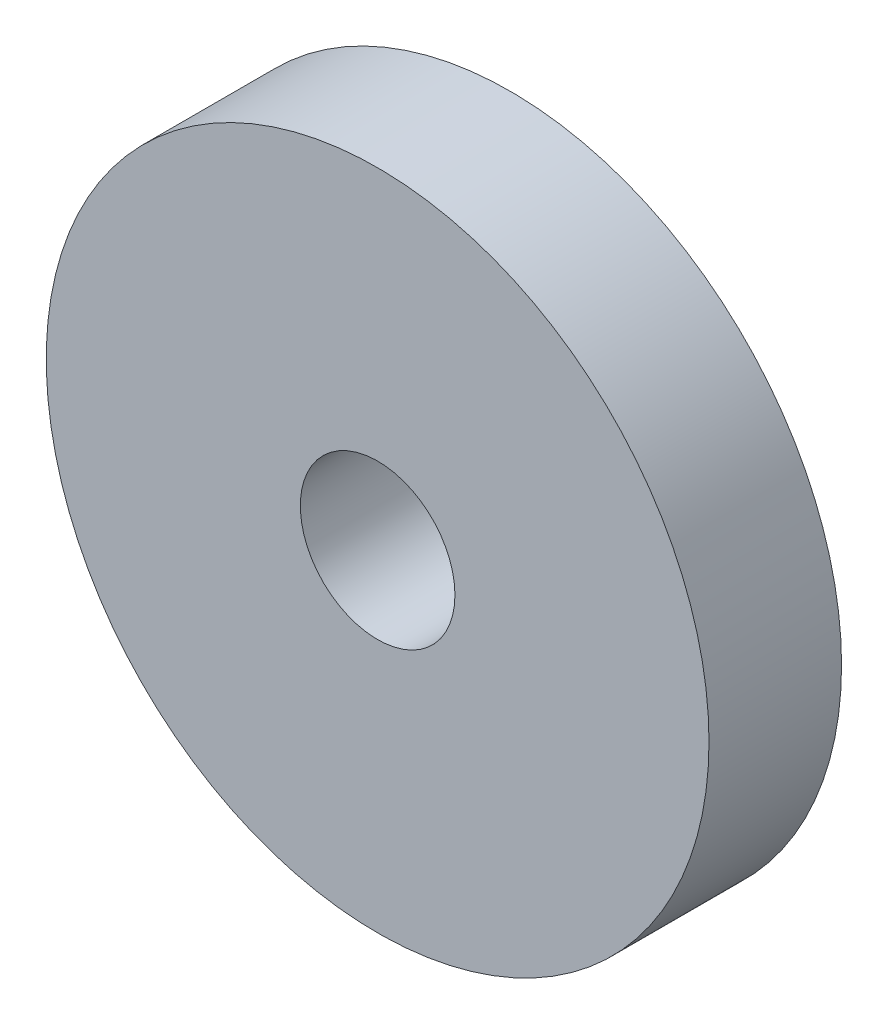
from build123d import *

# Parameters (mm, degrees)
SKETCH1_R           = 7.5
SKETCH1_R_2         = 1.75
BOSS_EXTRUDE1_DEPTH = 3


with BuildPart() as part:
    # Sketch1 → Boss-Extrude1 (new body)
    with BuildSketch(Plane.XY):
        with Locations((-39.876255841, -3e-09)):
            Circle(SKETCH1_R)
        with Locations((-39.876255841, -3e-09)):
            Circle(SKETCH1_R_2, mode=Mode.SUBTRACT)
    extrude(amount=BOSS_EXTRUDE1_DEPTH)


solid = part.part
